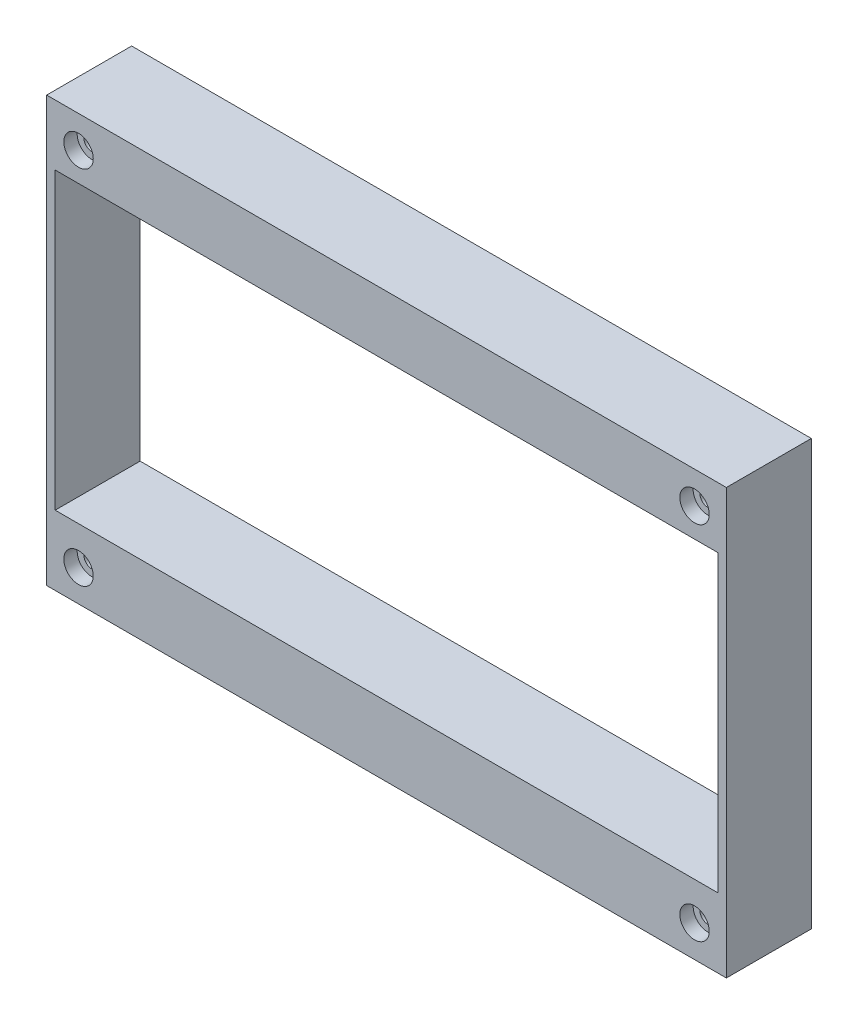
from build123d import *

# Parameters (mm, degrees)
SKETCH1_W                      = 101.6
SKETCH1_H                      = 63.5
BOSS_EXTRUDE1_DEPTH            = 12.7
SKETCH2_W                      = 99.06
SKETCH2_H                      = 44.03588005
CUT_EXTRUDE1_DEPTH             = 12.7
SKETCH3_R                      = 1.5875
CUT_EXTRUDE2_DEPTH             = 3.175
CBORE_FOR_M2_SHCS1_D           = 2.4
CBORE_FOR_M2_SHCS1_CBORE_D     = 4.4
CBORE_FOR_M2_SHCS1_CBORE_DEPTH = 2


with BuildPart() as part:
    # Sketch1 → Boss-Extrude1 (new body)
    with BuildSketch(Plane.XY):
        with Locations((50.8, 31.75)):
            Rectangle(SKETCH1_W, SKETCH1_H)
    extrude(amount=BOSS_EXTRUDE1_DEPTH)

    # Sketch2 → Cut-Extrude1 (cut)
    with BuildSketch(Plane.XY.offset(12.7)):
        with Locations((50.8, 32.4134102)):
            Rectangle(SKETCH2_W, SKETCH2_H)
    extrude(amount=-CUT_EXTRUDE1_DEPTH, mode=Mode.SUBTRACT)

    # Sketch3 → Cut-Extrude2 (cut)
    with BuildSketch(Plane(origin=(0, 0, 0), x_dir=(-1, 0, 0), z_dir=(0, 0, -1))):
        with Locations((-96.8375, 4.7625)):
            Circle(SKETCH3_R)
        with Locations((-96.8375, 58.7375)):
            Circle(SKETCH3_R)
        with Locations((-4.7625, 58.7375)):
            Circle(SKETCH3_R)
        with Locations((-4.7625, 4.7625)):
            Circle(SKETCH3_R)
    extrude(amount=-CUT_EXTRUDE2_DEPTH, mode=Mode.SUBTRACT)

    # CBORE for M2 SHCS1 (through all)
    with Locations(Plane.XY.offset(12.7)):
        with Locations((96.8375, 4.7625), (96.8375, 58.7375), (4.7625, 58.7375), (4.7625, 4.71678)):
            CounterBoreHole(CBORE_FOR_M2_SHCS1_D / 2, CBORE_FOR_M2_SHCS1_CBORE_D / 2, CBORE_FOR_M2_SHCS1_CBORE_DEPTH)


solid = part.part
